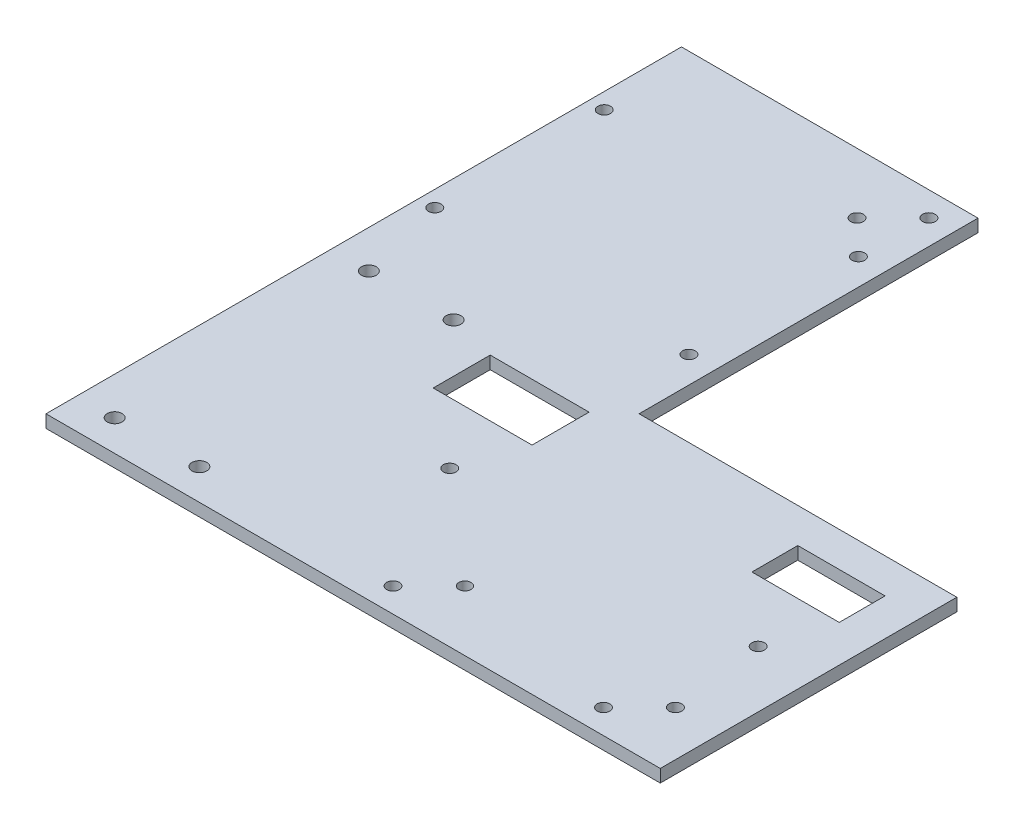
from build123d import *

# Parameters (mm, degrees)
SKETCH1_R           = 1.5
SKETCH1_R_2         = 1.44463942
SKETCH1_R_3         = 1.75
SKETCH1_W           = 23.332723566
SKETCH1_H           = 13.458477976
SKETCH1_W_2         = 20.606585233
SKETCH1_H_2         = 10.826007204
BOSS_EXTRUDE1_DEPTH = 3


with BuildPart() as part:
    # Sketch1 → Boss-Extrude1 (new body)
    with BuildSketch(Plane(origin=(0, 0, 0), x_dir=(1, 0, 0), z_dir=(0, 1, 0))):
        Polygon((-72.5, -35), (72.5, -35), (72.5, 35), (-2.5, 35), (-2.5, 115), (-72.5, 115), (-72.5, 35), align=None)
        with Locations(Location((3.654827994, -29.242640687, 0), (0, 0, 270))):
            Circle(SKETCH1_R, mode=Mode.SUBTRACT)
        with Locations(Location((12.140109368, -20.757359313, 0), (0, 0, 270))):
            Circle(SKETCH1_R_2, mode=Mode.SUBTRACT)
        with Locations(Location((53.338095075, -29.242640687, 0), (0, 0, 270))):
            Circle(SKETCH1_R, mode=Mode.SUBTRACT)
        with Locations(Location((61.823376449, -20.757359313, 0), (0, 0, 270))):
            Circle(SKETCH1_R, mode=Mode.SUBTRACT)
        with Locations(Location((-16.814355015, 100.757359313, 0), (0, 0, 270))):
            Circle(SKETCH1_R, mode=Mode.SUBTRACT)
        with Locations(Location((-8.329073641, 109.242640687, 0), (0, 0, 270))):
            Circle(SKETCH1_R, mode=Mode.SUBTRACT)
        with Locations(Location((-13.69982199, 1.5, 0), (0, 0, 270))):
            Circle(SKETCH1_R, mode=Mode.SUBTRACT)
        with Locations(Location((59.109237961, 1.5, 0), (0, 0, 270))):
            Circle(SKETCH1_R, mode=Mode.SUBTRACT)
        with Locations(Location((-63.584566194, -27.710636817, 0), (0, 0, 270))):
            Circle(SKETCH1_R_3, mode=Mode.SUBTRACT)
        with Locations(Location((-43.584566194, -27.710636817, 0), (0, 0, 270))):
            Circle(SKETCH1_R_3, mode=Mode.SUBTRACT)
        with Locations(Location((-43.584566194, 32.289363183, 0), (0, 0, 270))):
            Circle(SKETCH1_R_3, mode=Mode.SUBTRACT)
        with Locations(Location((-63.584566194, 32.289363183, 0), (0, 0, 270))):
            Circle(SKETCH1_R_3, mode=Mode.SUBTRACT)
        with Locations(Location((-68.740395312, 53.009730632, 0), (0, 0, 270))):
            Circle(SKETCH1_R, mode=Mode.SUBTRACT)
        with Locations(Location((-68.740395312, 93.009730632, 0), (0, 0, 270))):
            Circle(SKETCH1_R, mode=Mode.SUBTRACT)
        with Locations(Location((-8.740395312, 93.009730632, 0), (0, 0, 270))):
            Circle(SKETCH1_R, mode=Mode.SUBTRACT)
        with Locations(Location((-8.740395312, 53.009730632, 0), (0, 0, 270))):
            Circle(SKETCH1_R, mode=Mode.SUBTRACT)
        with Locations((-20.406757095, 22.7)):
            Rectangle(SKETCH1_W, SKETCH1_H, mode=Mode.SUBTRACT)
        with Locations((53.46751152, 21.383764614)):
            Rectangle(SKETCH1_W_2, SKETCH1_H_2, mode=Mode.SUBTRACT)
    extrude(amount=BOSS_EXTRUDE1_DEPTH)


solid = part.part
